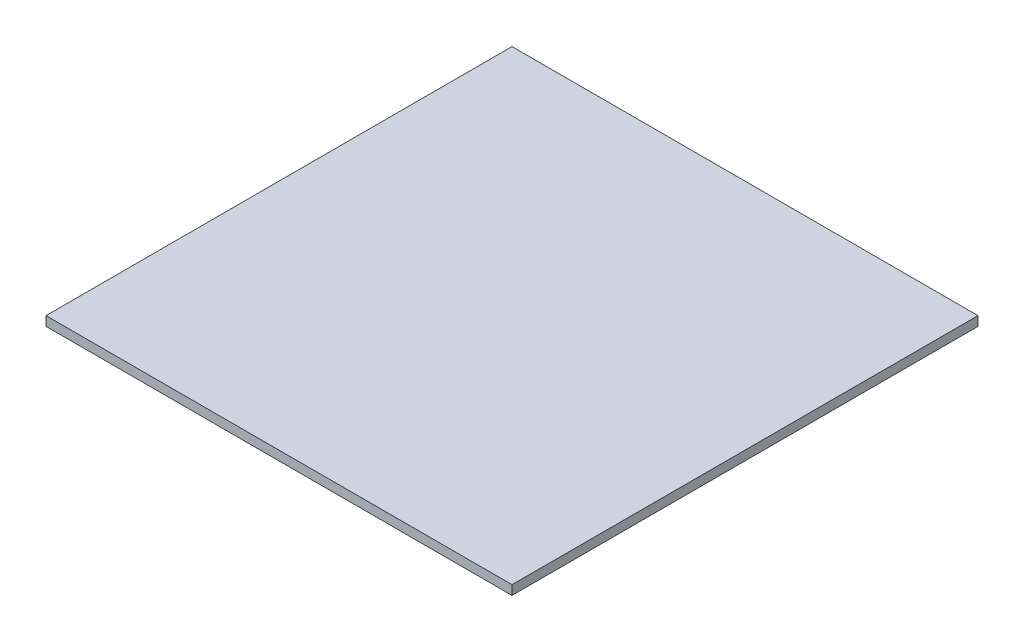
from build123d import *

# Parameters (mm, degrees)
SKETCH1_W      = 80
SKETCH1_H      = 80
PCB_BASE_DEPTH = 1.6


with BuildPart() as part:
    # Sketch1 → PCB BASE (new body)
    with BuildSketch(Plane(origin=(0, 0, 0), x_dir=(1, 0, 0), z_dir=(0, 1, 0))):
        Rectangle(SKETCH1_W, SKETCH1_H)
    extrude(amount=PCB_BASE_DEPTH)


solid = part.part
